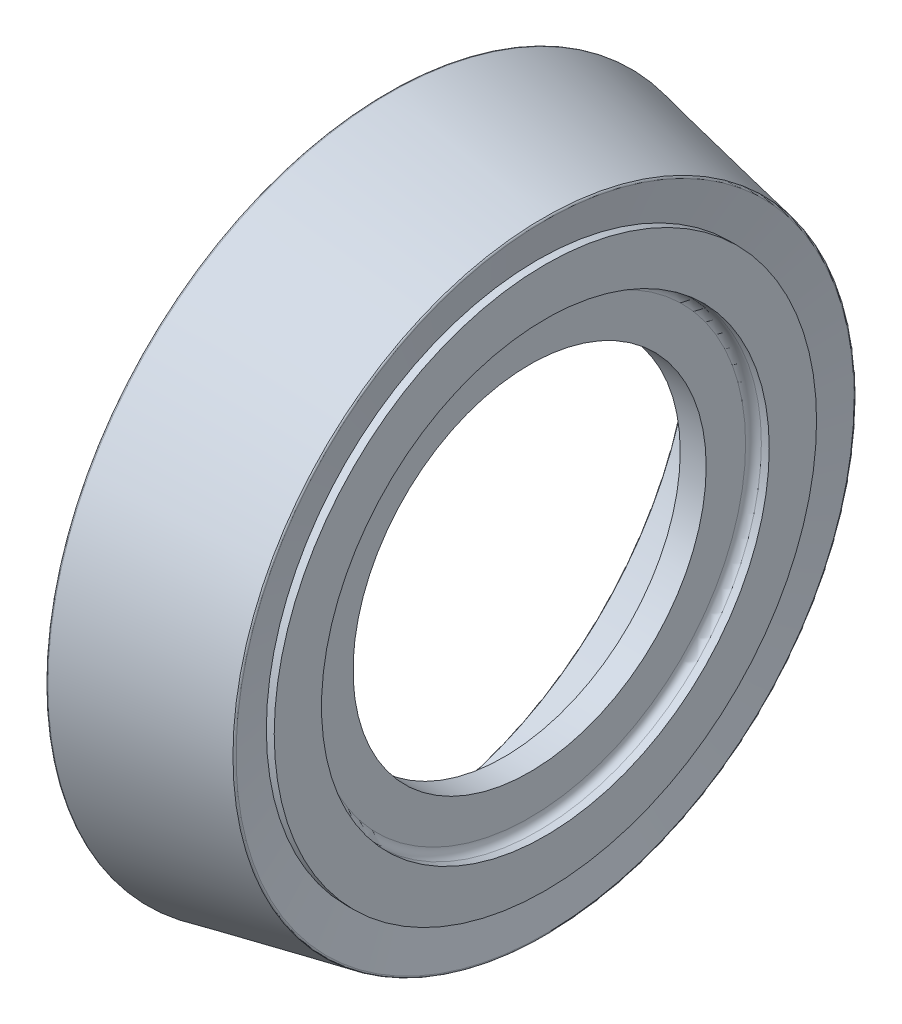
from build123d import *


with BuildPart() as part:
    # Szkic1 → Obrót1 (revolve)
    with BuildSketch(Plane.XY, mode=Mode.PRIVATE) as obr_t1_sk:
        with BuildLine():
            Line((0.901941932, 8.019611614), (-8.880388386, 9.976077677))
            ThreePointArc((-8.880388386, 9.976077677), (-8.963398891, 9.955353824), (-9, 9.87801961))
            Line((-9, 9.87801961), (-9, 7.58198039))
            ThreePointArc((-9, 7.58198039), (-8.977334214, 7.5185815), (-8.919611614, 7.483922323))
            Line((-8.919611614, 7.483922323), (-1.645644932, 6.029128986))
            Line((-1.645644932, 6.029128986), (-1.645644932, -0.5))
            Line((-1.645644932, -0.5), (0, -0.5))
            Line((0, -0.5), (0, 2))
            ThreePointArc((0, 2), (0.146446609, 2.353553391), (0.5, 2.5))
            Line((0.5, 2.5), (1, 2.5))
            Line((1, 2.5), (1, 5.5))
            Line((1, 5.5), (0.5, 5.5))
            Line((0.5, 5.5), (0.980388386, 7.901941932))
            ThreePointArc((0.980388386, 7.901941932), (0.965535348, 7.977023566), (0.901941932, 8.019611614))
        make_face()
    revolve(obr_t1_sk.sketch.rotate(Axis((0, -11.7, 0), (-1, 0, 0)), 90), axis=Axis((0, -11.7, 0), (-1, 0, 0)))


solid = part.part
